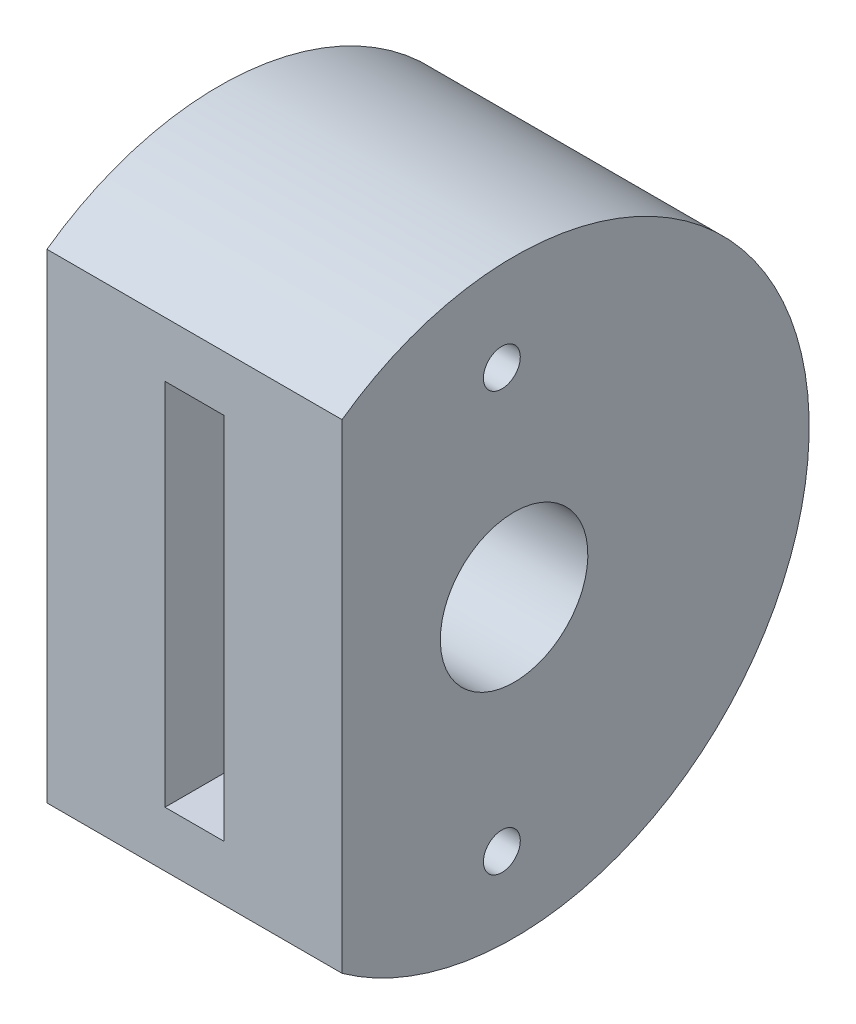
from build123d import *

# Parameters (mm, degrees)
BOSS_EXTRU_1_START      = -10
BOSS_EXTRU_1_DEPTH      = 80
ESQUISSE3_W             = 16
ESQUISSE3_H             = 100
ENL_V_MAT_EXTRU_1_DEPTH = 80
BOSS_EXTRU_2_DEPTH      = 80
CONG_1_R                = 11
ENL_V_MAT_EXTRU_2_REACH = 146.791
ESQUISSE8_R             = 20
ESQUISSE9_R             = 5
ENL_V_MAT_EXTRU_3_DEPTH = 80
ECHELLE1_SCALE          = 0.25


with BuildPart() as part:
    # Esquisse2 → Boss.-Extru.1 (new body)
    with BuildSketch(Plane.XY.offset(BOSS_EXTRU_1_START)):
        Polygon((-55.04572219, 21.601620468), (-55.04572219, -49.548379532), (-55.04572219, -83.308379532), (24.95427781, -83.308379532), (24.95427781, -43.249651956), (24.95427781, 27.900348044), (24.95427781, 46.691620468), (-55.04572219, 46.691620468), align=None)
    extrude(amount=BOSS_EXTRU_1_DEPTH)

    # Esquisse3 → Enlèv. mat.-Extru.1 (cut)
    with BuildSketch(Plane.XY.offset(70)):
        with Locations((-15.04572219, -18.308379532)):
            Rectangle(ESQUISSE3_W, ESQUISSE3_H)
    extrude(amount=-ENL_V_MAT_EXTRU_1_DEPTH, mode=Mode.SUBTRACT)

    # Esquisse6 → Boss.-Extru.2 (add)
    with BuildSketch(Plane(origin=(24.95427781, 0, 0), x_dir=(0, 0, -1), z_dir=(1, 0, 0))):
        with BuildLine():
            Line((-70, 46.691620468), (10, 46.691620468))
            Line((10, 46.691620468), (10, -83.308379532))
            Line((10, -83.308379532), (-70, -83.308379532))
            ThreePointArc((-70, -83.308379532), (56.636895265, -18.308379532), (-70, 46.691620468))
        make_face()
    extrude(amount=-BOSS_EXTRU_2_DEPTH)

    # Congé1
    cong_1_edges = [part.edges().sort_by_distance(p)[0] for p in [
        (-15.04572219, 31.691620468, -10),
        (-15.04572219, -68.308379532, -10),
    ]]
    fillet(cong_1_edges, radius=CONG_1_R)

    # Enlèv. mat.-Extru.2: up to this face of the body (flat: up to its plane)
    enl_v_mat_extru_2_end = Plane(part.part.faces().sort_by_distance((-55.04572219, -18.308379532, 12.636185619))[0])
    # Esquisse8 → Enlèv. mat.-Extru.2 (cut, up to the picked face)
    with BuildSketch(Plane(origin=(24.95427781, 0, 0), x_dir=(0, 0, -1), z_dir=(1, 0, 0)), mode=Mode.PRIVATE) as enl_v_mat_extru_2_sk1:
        with Locations(Location((-23.363104735, -18.308379532, 0), (0, 0, 90))):
            Circle(ESQUISSE8_R)
    enl_v_mat_extru_2_tool1 = split(extrude(enl_v_mat_extru_2_sk1.sketch, amount=-ENL_V_MAT_EXTRU_2_REACH, mode=Mode.PRIVATE), bisect_by=enl_v_mat_extru_2_end, keep=Keep.BOTH, mode=Mode.PRIVATE)
    add(enl_v_mat_extru_2_tool1.solids().sort_by(Axis((24.954278, -18.30838, 23.363105), (-1, 0, 0)))[0], mode=Mode.SUBTRACT)

    # Esquisse9 → Enlèv. mat.-Extru.3 (cut)
    with BuildSketch(Plane.ZY.offset(55.04572219)):
        with Locations(Location((26.681094555, 37.25802852, 0), (0, 0, 270))):
            Circle(ESQUISSE9_R)
        with Locations(Location((26.681094555, -76.2999152, 0), (0, 0, 270))):
            Circle(ESQUISSE9_R)
    extrude(amount=-ENL_V_MAT_EXTRU_3_DEPTH, mode=Mode.SUBTRACT)


with BuildPart() as part_1:
    # Echelle1: scaled about (-15.04572219, -18.295074577, 9.77346256)
    add(part.part.scale(ECHELLE1_SCALE).moved(Location((-11.284291642, -13.721305933, 7.33009692))))


solid = part_1.part
